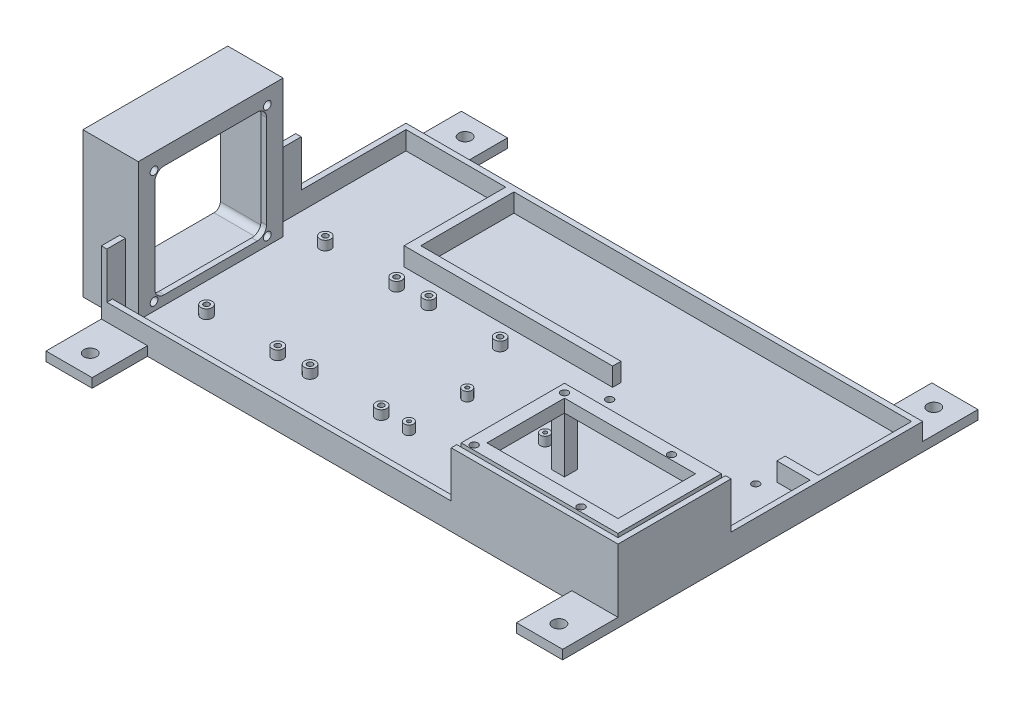
from build123d import *

# Parameters (mm, degrees)
SKETCH1_W             = 280
SKETCH1_H             = 165.1
FLOOR_2_DEPTH         = 4.38046443
SKETCH2_W             = 280
SKETCH2_H             = 165.1
SKETCH2_W_2           = 274
SKETCH2_H_2           = 159.1
WALL_DEPTH            = 10
RPI_START             = 30
SKETCH4_W             = 85
SKETCH4_H             = 56
SKETCH4_W_2           = 71
SKETCH4_H_2           = 42
RPI_STAND_DEPTH       = 7
SKETCH7_W             = 3
SKETCH7_H             = 105.333904831
TEMP_SUPPORT_DEPTH    = 25
SKETCH3_W             = 25
SKETCH3_H             = 30
SKETCH3_R             = 3.429
BRACKETS_DEPTH        = 5
FAN_HOLDER_DEPTH      = 20
FAN_HOLDER_DEPTH_BACK = 10
SKETCH5_W             = 78.5
SKETCH5_H             = 78.5
FAN_START             = -3
FAN_HOLE_DEPTH        = 3
SKETCH11_W            = 78.5
SKETCH11_H            = 78.5
SKETCH11_R            = 2.1
BOSS_EXTRUDE9_DEPTH   = 3
BOSS_EXTRUDE10_REACH  = 202.618
SKETCH12_W            = 7
SKETCH12_H            = 7
SKETCH13_R            = 3
SKETCH13_R_2          = 1.5
SKETCH13_R_3          = 2.5
SKETCH13_R_4          = 1
BOSS_EXTRUDE12_DEPTH  = 5
CUT_EXTRUDE1_START    = 5
SKETCH13_4_R          = 1.5
SKETCH13_4_R_2        = 1
CUT_EXTRUDE1_DEPTH    = 5
SKETCH13_5_R          = 2
CUT_EXTRUDE2_DEPTH    = 3
SKETCH16_W            = 18
SKETCH16_H            = 4.5
BOSS_EXTRUDE11_DEPTH  = 10
SKETCH17_R            = 2
CUT_EXTRUDE3_DEPTH    = 3


with BuildPart() as part:
    # Sketch1 → Floor 2 (new body)
    with BuildSketch(Plane(origin=(0, 0, 0), x_dir=(1, 0, 0), z_dir=(0, 1, 0))):
        Rectangle(SKETCH1_W, SKETCH1_H)
    extrude(amount=FLOOR_2_DEPTH)

    # Sketch2 → Wall (add)
    with BuildSketch(Plane(origin=(0, 4.38046443, 0), x_dir=(1, 0, 0), z_dir=(0, 1, 0))):
        Rectangle(SKETCH2_W, SKETCH2_H)
        Rectangle(SKETCH2_W_2, SKETCH2_H_2, mode=Mode.SUBTRACT)
    extrude(amount=WALL_DEPTH)

    # Sketch7 → Temp support (add)
    with BuildSketch(Plane(origin=(0, 14.38046443, 0), x_dir=(1, 0, 0), z_dir=(0, 1, 0))):
        with Locations((-138.5, -29.883047585)):
            Rectangle(SKETCH7_W, SKETCH7_H)
        Polygon((140, -82.55), (49.61228981, -82.55), (49.61228981, -79.55), (137, -79.55), (137, -21.306937857), (140, -21.306937857), (140, -79.55), align=None)
    extrude(amount=TEMP_SUPPORT_DEPTH)

    # Sketch3 → Brackets (add)
    # profile 1 of 4: a face of its own
    with BuildSketch(Plane(origin=(0, 0, 0), x_dir=(1, 0, 0), z_dir=(0, 1, 0))):
        with Locations((-127.5, 97.55)):
            Rectangle(SKETCH3_W, SKETCH3_H)
        with Locations(Location((-127, 101.6, 0), (0, 0, 270))):
            Circle(SKETCH3_R, mode=Mode.SUBTRACT)
    # profile 2 of 4: a face of its own
    with BuildSketch(Plane(origin=(0, 0, 0), x_dir=(1, 0, 0), z_dir=(0, 1, 0))):
        with Locations((127.5, 97.55)):
            Rectangle(SKETCH3_W, SKETCH3_H)
        with Locations(Location((127, 101.6, 0), (0, 0, 270))):
            Circle(SKETCH3_R, mode=Mode.SUBTRACT)
    # profile 3 of 4: a face of its own
    with BuildSketch(Plane(origin=(0, 0, 0), x_dir=(1, 0, 0), z_dir=(0, 1, 0))):
        with Locations((-127.5, -97.55)):
            Rectangle(SKETCH3_W, SKETCH3_H)
        with Locations(Location((-127, -101.6, 0), (0, 0, 270))):
            Circle(SKETCH3_R, mode=Mode.SUBTRACT)
    # profile 4 of 4: a face of its own
    with BuildSketch(Plane(origin=(0, 0, 0), x_dir=(1, 0, 0), z_dir=(0, 1, 0))):
        with Locations((127.5, -97.55)):
            Rectangle(SKETCH3_W, SKETCH3_H)
        with Locations(Location((127, -101.6, 0), (0, 0, 270))):
            Circle(SKETCH3_R, mode=Mode.SUBTRACT)
    extrude(amount=BRACKETS_DEPTH)

    # Sketch5 → Fan Holder (add, two sides: drawn at the far end of the back side and taken through both)
    with BuildSketch(Plane.ZY.offset(140).offset(-FAN_HOLDER_DEPTH_BACK)):
        with Locations((33.3, 39.63046443)):
            Rectangle(SKETCH5_W, SKETCH5_H)
        with BuildLine():
            Line((65.05, 4.38046443), (1.55, 4.38046443))
            ThreePointArc((1.55, 4.38046443), (-0.924873734, 5.405590696), (-1.95, 7.88046443))
            Line((-1.95, 7.88046443), (-1.95, 71.38046443))
            ThreePointArc((-1.95, 71.38046443), (-0.924873734, 73.855338165), (1.55, 74.88046443))
            Line((1.55, 74.88046443), (65.05, 74.88046443))
            ThreePointArc((65.05, 74.88046443), (67.524873734, 73.855338165), (68.55, 71.38046443))
            Line((68.55, 71.38046443), (68.55, 7.88046443))
            ThreePointArc((68.55, 7.88046443), (67.524873734, 5.405590696), (65.05, 4.38046443))
        make_face(mode=Mode.SUBTRACT)
    extrude(amount=FAN_HOLDER_DEPTH + FAN_HOLDER_DEPTH_BACK)

    # Sketch8 → Fan hole (cut)
    with BuildSketch(Plane.ZY.offset(140).offset(FAN_START)):
        with BuildLine():
            Line((-1.95, 39.38046443), (-1.95, 7.88046443))
            ThreePointArc((-1.95, 7.88046443), (-0.924873734, 5.405590696), (1.55, 4.38046443))
            Line((1.55, 4.38046443), (65.05, 4.38046443))
            ThreePointArc((65.05, 4.38046443), (67.524873734, 5.405590696), (68.55, 7.88046443))
            Line((68.55, 7.88046443), (68.55, 39.38046443))
            Line((68.55, 39.38046443), (-1.95, 39.38046443))
        make_face()
    extrude(amount=FAN_HOLE_DEPTH, mode=Mode.SUBTRACT)

    # Sketch11 → Boss-Extrude9 (add)
    with BuildSketch(Plane.ZY.offset(130)):
        with Locations((33.3, 39.63046443)):
            Rectangle(SKETCH11_W, SKETCH11_H)
        with Locations((2.6, 70.33046443)):
            Circle(SKETCH11_R, mode=Mode.SUBTRACT)
        with Locations((64, 70.33046443)):
            Circle(SKETCH11_R, mode=Mode.SUBTRACT)
        with Locations((64, 8.93046443)):
            Circle(SKETCH11_R, mode=Mode.SUBTRACT)
        with Locations((2.6, 8.93046443)):
            Circle(SKETCH11_R, mode=Mode.SUBTRACT)
        with BuildLine():
            Line((3.05, 64.88046443), (3.05, 14.38046443))
            ThreePointArc((3.05, 14.38046443), (4.514466094, 10.844930524), (8.05, 9.38046443))
            Line((8.05, 9.38046443), (58.55, 9.38046443))
            ThreePointArc((58.55, 9.38046443), (62.085533906, 10.844930524), (63.55, 14.38046443))
            Line((63.55, 14.38046443), (63.55, 64.88046443))
            ThreePointArc((63.55, 64.88046443), (62.085533906, 68.415998336), (58.55, 69.88046443))
            Line((58.55, 69.88046443), (8.05, 69.88046443))
            ThreePointArc((8.05, 69.88046443), (4.514466094, 68.415998336), (3.05, 64.88046443))
        make_face(mode=Mode.SUBTRACT)
    extrude(amount=BOSS_EXTRUDE9_DEPTH)

    # Sketch12 → Boss-Extrude10 (add, up to next)
    with BuildSketch(Plane.XZ.offset(-34.38046443), mode=Mode.PRIVATE) as boss_extrude10_sk1:
        with Locations((55.5, 27.05)):
            Rectangle(SKETCH12_W, SKETCH12_H)
    boss_extrude10_tool1 = extrude(boss_extrude10_sk1.sketch, amount=BOSS_EXTRUDE10_REACH, mode=Mode.PRIVATE) - part.part


with BuildPart() as body_2:
    # Sketch4 → Rpi stand (new body)
    with BuildSketch(Plane(origin=(0, 4.38046443, 0), x_dir=(1, 0, 0), z_dir=(0, 1, 0)).offset(RPI_START)):
        with Locations((94.5, -51.55)):
            Rectangle(SKETCH4_W, SKETCH4_H)
        with Locations((94.5, -51.55)):
            Rectangle(SKETCH4_W_2, SKETCH4_H_2, mode=Mode.SUBTRACT)
    extrude(amount=RPI_STAND_DEPTH)


with BuildPart() as part_1:
    add(part.part)

    add(body_2.part)  # Boss-Extrude10 merges body 2
    add(boss_extrude10_tool1.solids().sort_by_distance((55.5, 34.380464, 27.05))[0])

    # Sketch13 → Boss-Extrude12 (add)
    # profile 1 of 24: a face of its own
    with BuildSketch(Plane(origin=(0, 4.38046443, 0), x_dir=(1, 0, 0), z_dir=(0, 1, 0))):
        with Locations(Location((-75.4, 12.85, 0), (0, 0, 90))):
            Circle(SKETCH13_R)
        with Locations((-75.4, 12.85)):
            Circle(SKETCH13_R_2, mode=Mode.SUBTRACT)
    # profile 2 of 24: a face of its own
    with BuildSketch(Plane(origin=(0, 4.38046443, 0), x_dir=(1, 0, 0), z_dir=(0, 1, 0))):
        with Locations((-75.4, 12.85)):
            Circle(SKETCH13_R_2)
    # profile 3 of 24: a face of its own
    with BuildSketch(Plane(origin=(0, 4.38046443, 0), x_dir=(1, 0, 0), z_dir=(0, 1, 0))):
        with Locations(Location((-57.9, 12.85, 0), (0, 0, 90))):
            Circle(SKETCH13_R)
        with Locations((-57.9, 12.85)):
            Circle(SKETCH13_R_2, mode=Mode.SUBTRACT)
    # profile 4 of 24: a face of its own
    with BuildSketch(Plane(origin=(0, 4.38046443, 0), x_dir=(1, 0, 0), z_dir=(0, 1, 0))):
        with Locations((-57.9, 12.85)):
            Circle(SKETCH13_R_2)
    # profile 5 of 24: a face of its own
    with BuildSketch(Plane(origin=(0, 4.38046443, 0), x_dir=(1, 0, 0), z_dir=(0, 1, 0))):
        with Locations(Location((-114, 12.85, 0), (0, 0, 90))):
            Circle(SKETCH13_R)
        with Locations((-114, 12.85)):
            Circle(SKETCH13_R_2, mode=Mode.SUBTRACT)
    # profile 6 of 24: a face of its own
    with BuildSketch(Plane(origin=(0, 4.38046443, 0), x_dir=(1, 0, 0), z_dir=(0, 1, 0))):
        with Locations((-114, 12.85)):
            Circle(SKETCH13_R_2)
    # profile 7 of 24: a face of its own
    with BuildSketch(Plane(origin=(0, 4.38046443, 0), x_dir=(1, 0, 0), z_dir=(0, 1, 0))):
        with Locations(Location((-19.3, 12.85, 0), (0, 0, 90))):
            Circle(SKETCH13_R)
        with Locations((-19.3, 12.85)):
            Circle(SKETCH13_R_2, mode=Mode.SUBTRACT)
    # profile 8 of 24: a face of its own
    with BuildSketch(Plane(origin=(0, 4.38046443, 0), x_dir=(1, 0, 0), z_dir=(0, 1, 0))):
        with Locations((-19.3, 12.85)):
            Circle(SKETCH13_R_2)
    # profile 9 of 24: a face of its own
    with BuildSketch(Plane(origin=(0, 4.38046443, 0), x_dir=(1, 0, 0), z_dir=(0, 1, 0))):
        with Locations(Location((-114, -51.55, 0), (0, 0, 90))):
            Circle(SKETCH13_R)
        with Locations((-114, -51.55)):
            Circle(SKETCH13_R_2, mode=Mode.SUBTRACT)
    # profile 10 of 24: a face of its own
    with BuildSketch(Plane(origin=(0, 4.38046443, 0), x_dir=(1, 0, 0), z_dir=(0, 1, 0))):
        with Locations((-114, -51.55)):
            Circle(SKETCH13_R_2)
    # profile 11 of 24: a face of its own
    with BuildSketch(Plane(origin=(0, 4.38046443, 0), x_dir=(1, 0, 0), z_dir=(0, 1, 0))):
        with Locations(Location((-75.4, -51.55, 0), (0, 0, 90))):
            Circle(SKETCH13_R)
        with Locations((-75.4, -51.55)):
            Circle(SKETCH13_R_2, mode=Mode.SUBTRACT)
    # profile 12 of 24: a face of its own
    with BuildSketch(Plane(origin=(0, 4.38046443, 0), x_dir=(1, 0, 0), z_dir=(0, 1, 0))):
        with Locations((-75.4, -51.55)):
            Circle(SKETCH13_R_2)
    # profile 13 of 24: a face of its own
    with BuildSketch(Plane(origin=(0, 4.38046443, 0), x_dir=(1, 0, 0), z_dir=(0, 1, 0))):
        with Locations(Location((-57.9, -51.55, 0), (0, 0, 90))):
            Circle(SKETCH13_R)
        with Locations((-57.9, -51.55)):
            Circle(SKETCH13_R_2, mode=Mode.SUBTRACT)
    # profile 14 of 24: a face of its own
    with BuildSketch(Plane(origin=(0, 4.38046443, 0), x_dir=(1, 0, 0), z_dir=(0, 1, 0))):
        with Locations((-57.9, -51.55)):
            Circle(SKETCH13_R_2)
    # profile 15 of 24: a face of its own
    with BuildSketch(Plane(origin=(0, 4.38046443, 0), x_dir=(1, 0, 0), z_dir=(0, 1, 0))):
        with Locations(Location((-19.3, -51.55, 0), (0, 0, 90))):
            Circle(SKETCH13_R)
        with Locations((-19.3, -51.55)):
            Circle(SKETCH13_R_2, mode=Mode.SUBTRACT)
    # profile 16 of 24: a face of its own
    with BuildSketch(Plane(origin=(0, 4.38046443, 0), x_dir=(1, 0, 0), z_dir=(0, 1, 0))):
        with Locations((-19.3, -51.55)):
            Circle(SKETCH13_R_2)
    # profile 17 of 24: a face of its own
    with BuildSketch(Plane(origin=(0, 4.38046443, 0), x_dir=(1, 0, 0), z_dir=(0, 1, 0))):
        with Locations(Location((-4.3, -51.55, 0), (0, 0, 90))):
            Circle(SKETCH13_R_3)
        with Locations((-4.3, -51.55)):
            Circle(SKETCH13_R_4, mode=Mode.SUBTRACT)
    # profile 18 of 24: a face of its own
    with BuildSketch(Plane(origin=(0, 4.38046443, 0), x_dir=(1, 0, 0), z_dir=(0, 1, 0))):
        with Locations((-4.3, -51.55)):
            Circle(SKETCH13_R_4)
    # profile 19 of 24: a face of its own
    with BuildSketch(Plane(origin=(0, 4.38046443, 0), x_dir=(1, 0, 0), z_dir=(0, 1, 0))):
        with Locations(Location((-4.3, -19.95, 0), (0, 0, 90))):
            Circle(SKETCH13_R_3)
        with Locations((-4.3, -19.95)):
            Circle(SKETCH13_R_4, mode=Mode.SUBTRACT)
    # profile 20 of 24: a face of its own
    with BuildSketch(Plane(origin=(0, 4.38046443, 0), x_dir=(1, 0, 0), z_dir=(0, 1, 0))):
        with Locations((-4.3, -19.95)):
            Circle(SKETCH13_R_4)
    # profile 21 of 24: a face of its own
    with BuildSketch(Plane(origin=(0, 4.38046443, 0), x_dir=(1, 0, 0), z_dir=(0, 1, 0))):
        with Locations(Location((37.87, -19.95, 0), (0, 0, 90))):
            Circle(SKETCH13_R_3)
        with Locations((37.87, -19.95)):
            Circle(SKETCH13_R_4, mode=Mode.SUBTRACT)
    # profile 22 of 24: a face of its own
    with BuildSketch(Plane(origin=(0, 4.38046443, 0), x_dir=(1, 0, 0), z_dir=(0, 1, 0))):
        with Locations((37.87, -19.95)):
            Circle(SKETCH13_R_4)
    # profile 23 of 24: a face of its own
    with BuildSketch(Plane(origin=(0, 4.38046443, 0), x_dir=(1, 0, 0), z_dir=(0, 1, 0))):
        with Locations(Location((37.87, -51.55, 0), (0, 0, 90))):
            Circle(SKETCH13_R_3)
        with Locations((37.87, -51.55)):
            Circle(SKETCH13_R_4, mode=Mode.SUBTRACT)
    # profile 24 of 24: a face of its own
    with BuildSketch(Plane(origin=(0, 4.38046443, 0), x_dir=(1, 0, 0), z_dir=(0, 1, 0))):
        with Locations((37.87, -51.55)):
            Circle(SKETCH13_R_4)
    extrude(amount=BOSS_EXTRUDE12_DEPTH)

    # Sketch13<4> → Cut-Extrude1 (cut)
    with BuildSketch(Plane(origin=(0, 4.38046443, 0), x_dir=(1, 0, 0), z_dir=(0, 1, 0)).offset(CUT_EXTRUDE1_START)):
        with Locations(Location((-114, -51.55, 0), (0, 0, 270))):
            Circle(SKETCH13_4_R)
        with Locations(Location((-114, 12.85, 0), (0, 0, 270))):
            Circle(SKETCH13_4_R)
        with Locations(Location((-75.4, 12.85, 0), (0, 0, 270))):
            Circle(SKETCH13_4_R)
        with Locations(Location((-75.4, -51.55, 0), (0, 0, 270))):
            Circle(SKETCH13_4_R)
        with Locations(Location((-57.9, 12.85, 0), (0, 0, 270))):
            Circle(SKETCH13_4_R)
        with Locations(Location((-57.9, -51.55, 0), (0, 0, 270))):
            Circle(SKETCH13_4_R)
        with Locations(Location((-19.3, -51.55, 0), (0, 0, 270))):
            Circle(SKETCH13_4_R)
        with Locations(Location((-19.3, 12.85, 0), (0, 0, 270))):
            Circle(SKETCH13_4_R)
        with Locations(Location((-4.3, -51.55, 0), (0, 0, 270))):
            Circle(SKETCH13_4_R_2)
        with Locations(Location((-4.3, -19.95, 0), (0, 0, 270))):
            Circle(SKETCH13_4_R_2)
        with Locations(Location((37.87, -19.95, 0), (0, 0, 270))):
            Circle(SKETCH13_4_R_2)
        with Locations(Location((37.87, -51.55, 0), (0, 0, 270))):
            Circle(SKETCH13_4_R_2)
    extrude(amount=-CUT_EXTRUDE1_DEPTH, mode=Mode.SUBTRACT)

    # Sketch13<5> → Cut-Extrude2 (cut)
    with BuildSketch(Plane(origin=(0, 4.38046443, 0), x_dir=(1, 0, 0), z_dir=(0, 1, 0))):
        with Locations(Location((114.04, 18.05, 0), (0, 0, 270))):
            Circle(SKETCH13_5_R)
        with Locations(Location((34.84, 18.05, 0), (0, 0, 270))):
            Circle(SKETCH13_5_R)
    extrude(amount=-CUT_EXTRUDE2_DEPTH, mode=Mode.SUBTRACT)

    # Sketch16 → Boss-Extrude11 (add)
    with BuildSketch(Plane(origin=(0, 4.38046443, 0), x_dir=(1, 0, 0), z_dir=(0, 1, 0))):
        Polygon((-83, 79.55), (-83, 24.55), (30, 24.55), (30, 29.05), (-78.5, 29.05), (-78.5, 79.55), align=None)
        with Locations((128, 26.8)):
            Rectangle(SKETCH16_W, SKETCH16_H)
    extrude(amount=BOSS_EXTRUDE11_DEPTH)

    # Sketch17 → Cut-Extrude3 (cut)
    with BuildSketch(Plane(origin=(0, 41.38046443, 0), x_dir=(1, 0, 0), z_dir=(0, 1, 0))):
        with Locations(Location((56.5, -28.05, 0), (0, 0, 270))):
            Circle(SKETCH17_R)
        with Locations(Location((114.5, -28.05, 0), (0, 0, 270))):
            Circle(SKETCH17_R)
        with Locations(Location((114.5, -77.05, 0), (0, 0, 270))):
            Circle(SKETCH17_R)
        with Locations(Location((56.5, -77.05, 0), (0, 0, 270))):
            Circle(SKETCH17_R)
    extrude(amount=-CUT_EXTRUDE3_DEPTH, mode=Mode.SUBTRACT)


solid = part_1.part
